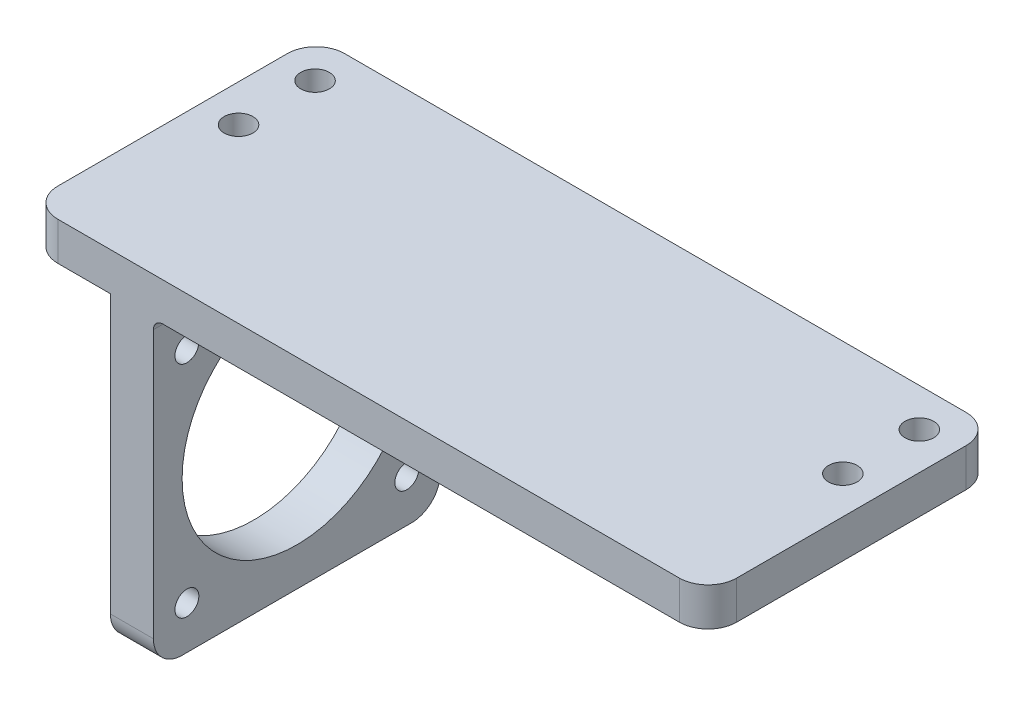
from build123d import *

# Parameters (mm, degrees)
SKETCH_1_W          = 71
SKETCH_1_H          = 30
SKETCH_1_R          = 1.5
EXTRUDE_1_DEPTH     = 4
FILLET_1_R          = 3
SKETCH_3_W          = 4.5
SKETCH_3_H          = 30
EXTRUDE_3_DEPTH     = 32
SKETCH_4_R          = 1.25
SKETCH_4_R_2        = 12
CUT_EXTRUDE_1_DEPTH = 30
FILLET_2_R          = 3
FILLET_3_R          = 1


with BuildPart() as part:
    # 草图1 → 凸台-拉伸1 (new body)
    with BuildSketch(Plane(origin=(0, 0, 0), x_dir=(1, 0, 0), z_dir=(0, 1, 0))):
        Rectangle(SKETCH_1_W, SKETCH_1_H)
        with Locations(Location((31.6, 11, 0), (0, 0, 270))):
            Circle(SKETCH_1_R, mode=Mode.SUBTRACT)
        with Locations(Location((31.6, 3, 0), (0, 0, 90))):
            Circle(SKETCH_1_R, mode=Mode.SUBTRACT)
        with Locations(Location((-31.6, 3, 0), (0, 0, 270))):
            Circle(SKETCH_1_R, mode=Mode.SUBTRACT)
        with Locations(Location((-31.6, 11, 0), (0, 0, 90))):
            Circle(SKETCH_1_R, mode=Mode.SUBTRACT)
    extrude(amount=EXTRUDE_1_DEPTH)

    # 圆角1
    fillet_1_edges = [part.edges().sort_by_distance(p)[0] for p in [
        (35.5, 2, 15),
        (-35.5, 2, 15),
        (-35.5, 2, -15),
        (35.5, 2, -15),
    ]]
    fillet(fillet_1_edges, radius=FILLET_1_R)

    # 草图3 → 凸台-拉伸3 (add)
    with BuildSketch(Plane.XZ):
        with Locations((-24.75, 0)):
            Rectangle(SKETCH_3_W, SKETCH_3_H)
    extrude(amount=EXTRUDE_3_DEPTH)

    # 草图4 → 切除-拉伸1 (cut)
    with BuildSketch(Plane.ZY.offset(27)):
        with Locations((11.5, -4.5)):
            Circle(SKETCH_4_R)
        with Locations((11.5, -27.5)):
            Circle(SKETCH_4_R)
        with Locations((-11.5, -27.5)):
            Circle(SKETCH_4_R)
        with Locations((-11.5, -4.5)):
            Circle(SKETCH_4_R)
        with Locations((0, -16)):
            Circle(SKETCH_4_R_2)
    extrude(amount=-CUT_EXTRUDE_1_DEPTH, mode=Mode.SUBTRACT)

    # 圆角2
    fillet_2_edges = [part.edges().sort_by_distance(p)[0] for p in [
        (-24.75, -32, -15),
        (-24.75, -32, 15),
    ]]
    fillet(fillet_2_edges, radius=FILLET_2_R)

    # 圆角3
    fillet_3_edges = [part.edges().sort_by_distance(p)[0] for p in [
        (-22.5, 0, 0),
    ]]
    fillet(fillet_3_edges, radius=FILLET_3_R)


solid = part.part
